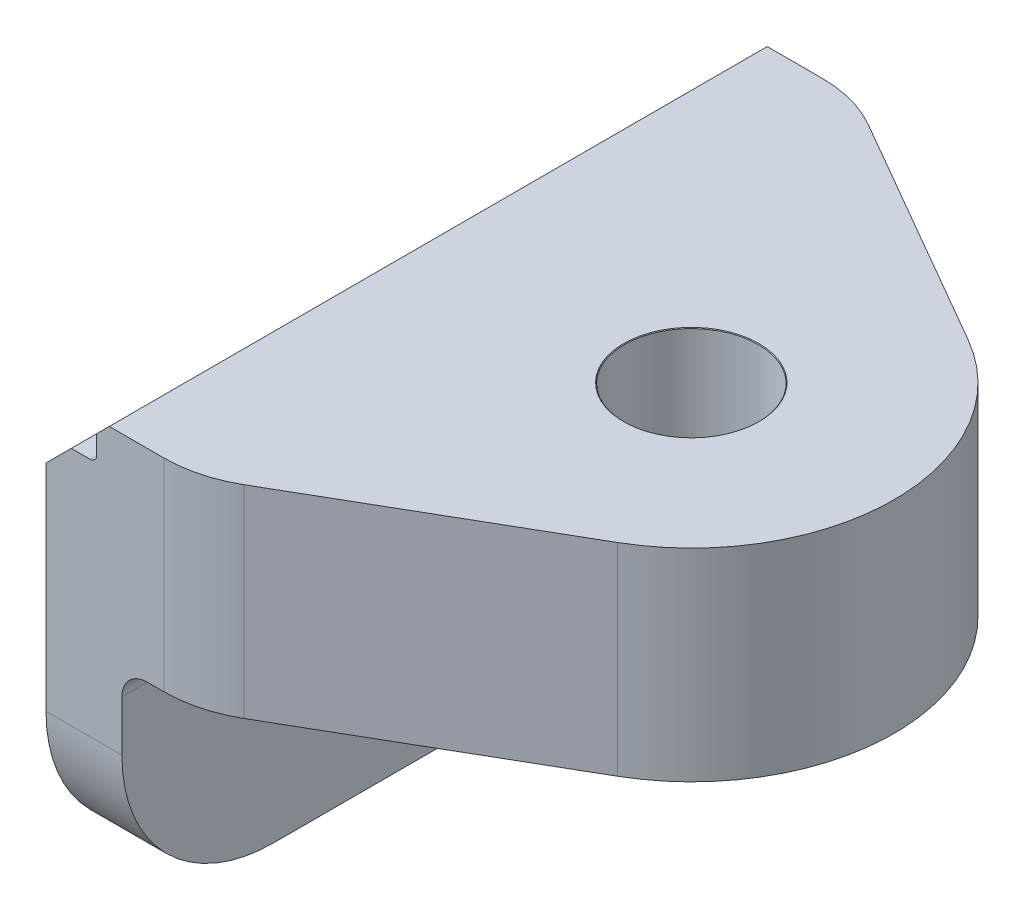
from build123d import *

# Parameters (mm, degrees)
BOSS_EXTRUDE1_DEPTH       = 4
FILLET1_R                 = 8
SKETCH7_W                 = 3
SKETCH7_H                 = 26
BOSS_EXTRUDE3_DEPTH       = 15.5
M3X0_5_TAPPED_HOLE1_D     = 2.5
M3X0_5_TAPPED_HOLE1_DEPTH = 7.5
M3X0_5_TAPPED_HOLE1_TIP   = 0.751075774
M3_CLEARANCE_HOLE2_D      = 3.4
SKETCH12_W                = 1
SKETCH12_H                = 26
BOSS_EXTRUDE4_DEPTH       = 2
FILLET4_R                 = 6
FILLET5_R                 = 1
FILLET6_R                 = 5
FILLET7_R                 = 0.25
CHAMFER1_SIZE             = 1
CHAMFER2_SIZE             = 0.5


with BuildPart() as part:
    # Sketch1 → Boss-Extrude1 (new, symmetric)
    with BuildSketch(Plane(origin=(0, 0, 0), x_dir=(1, 0, 0), z_dir=(0, 1, 0))):
        Polygon((0, 0), (0, 13), (3, 13), (25.516660498, 0), (3, -13), (0, -13), align=None)
    extrude(amount=BOSS_EXTRUDE1_DEPTH, both=True)

    # Fillet1
    fillet1_edges = [part.edges().sort_by_distance(p)[0] for p in [
        (25.516660498, 0, 0),
    ]]
    fillet(fillet1_edges, radius=FILLET1_R)

    # Sketch7 → Boss-Extrude3 (add)
    with BuildSketch(Plane(origin=(0, 2.5, 0), x_dir=(1, 0, 0), z_dir=(0, 1, 0))):
        with Locations((-1.5, 0)):
            Rectangle(SKETCH7_W, SKETCH7_H)
    extrude(amount=-BOSS_EXTRUDE3_DEPTH)

    # M3x0.5 Tapped Hole1
    with Locations(Plane.ZY.offset(3)):
        with Locations((9.5, -1), (-9.5, -1)):
            Hole(M3X0_5_TAPPED_HOLE1_D / 2, depth=M3X0_5_TAPPED_HOLE1_DEPTH)
            with Locations((0, 0, -(M3X0_5_TAPPED_HOLE1_DEPTH + M3X0_5_TAPPED_HOLE1_TIP / 2))):  # 118° drill point
                Cone(0, M3X0_5_TAPPED_HOLE1_D / 2, M3X0_5_TAPPED_HOLE1_TIP, mode=Mode.SUBTRACT)

    # M3 Clearance Hole2 (through all)
    with Locations(Plane.ZY.offset(3)):
        with Locations((-5, -8), (5, -8)):
            Hole(M3_CLEARANCE_HOLE2_D / 2)

    # Sketch12 → Boss-Extrude4 (add)
    with BuildSketch(Plane(origin=(0, 4, 0), x_dir=(1, 0, 0), z_dir=(0, 1, 0))):
        with Locations((-0.5, 0)):
            Rectangle(SKETCH12_W, SKETCH12_H)
    extrude(amount=-BOSS_EXTRUDE4_DEPTH)

    # Sketch20 → CBORE for M5 SHCS1 (revolve, cut)
    with BuildSketch(Plane(origin=(9.5, -4, 0), x_dir=(0, 0, -1), z_dir=(1, 0, 0))):
        Polygon((0, 0), (0, 8), (2.675, 8), (2.65, 7.975), (2.65, 4.025), (2.675, 4), (5, 4), (5, 0), align=None)
    revolve(axis=Axis((9.5, -10.35, 0), (0, 1, 0)), mode=Mode.SUBTRACT)

    # Fillet4
    fillet4_edges = [part.edges().sort_by_distance(p)[0] for p in [
        (-1.5, -13, 13),
        (-1.5, -13, -13),
    ]]
    fillet(fillet4_edges, radius=FILLET4_R)

    # Fillet5
    fillet5_edges = [part.edges().sort_by_distance(p)[0] for p in [
        (0, -4, 0),
    ]]
    fillet(fillet5_edges, radius=FILLET5_R)

    # Fillet6
    fillet6_edges = [part.edges().sort_by_distance(p)[0] for p in [
        (3, 0, -13),
        (3, 0, 13),
    ]]
    fillet(fillet6_edges, radius=FILLET6_R)

    # Fillet7
    fillet7_edges = [part.edges().sort_by_distance(p)[0] for p in [
        (-1, 2.5, 0),
    ]]
    fillet(fillet7_edges, radius=FILLET7_R)

    # Chamfer1
    chamfer1_edges = [part.edges().sort_by_distance(p)[0] for p in [
        (-3, 2.5, 0),
    ]]
    chamfer(chamfer1_edges, length=CHAMFER1_SIZE)

    # Chamfer2
    chamfer2_edges = [part.edges().sort_by_distance(p)[0] for p in [
        (-1, 4, 0),
    ]]
    chamfer(chamfer2_edges, length=CHAMFER2_SIZE)


solid = part.part
